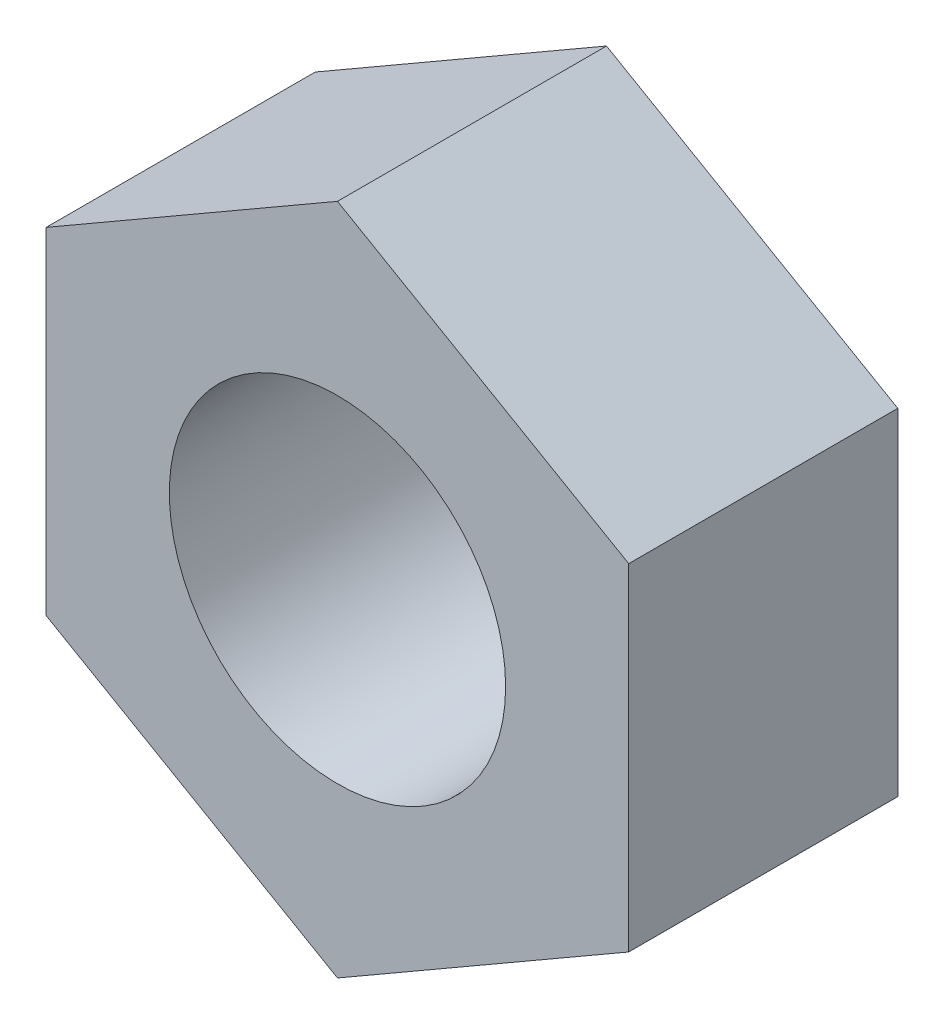
from build123d import *

# Parameters (mm, degrees)
SKICA1_R                = 3
P_IDAT_VYSUNUT_M1_DEPTH = 4.8


with BuildPart() as part:
    # Skica1 → Přidat vysunutím1 (new body)
    with BuildSketch(Plane.XY):
        Polygon((0, 6), (-5.196152423, 3), (-5.196152423, -3), (0, -6), (5.196152423, -3), (5.196152423, 3), align=None)
        Circle(SKICA1_R, mode=Mode.SUBTRACT)
    extrude(amount=P_IDAT_VYSUNUT_M1_DEPTH)


solid = part.part
